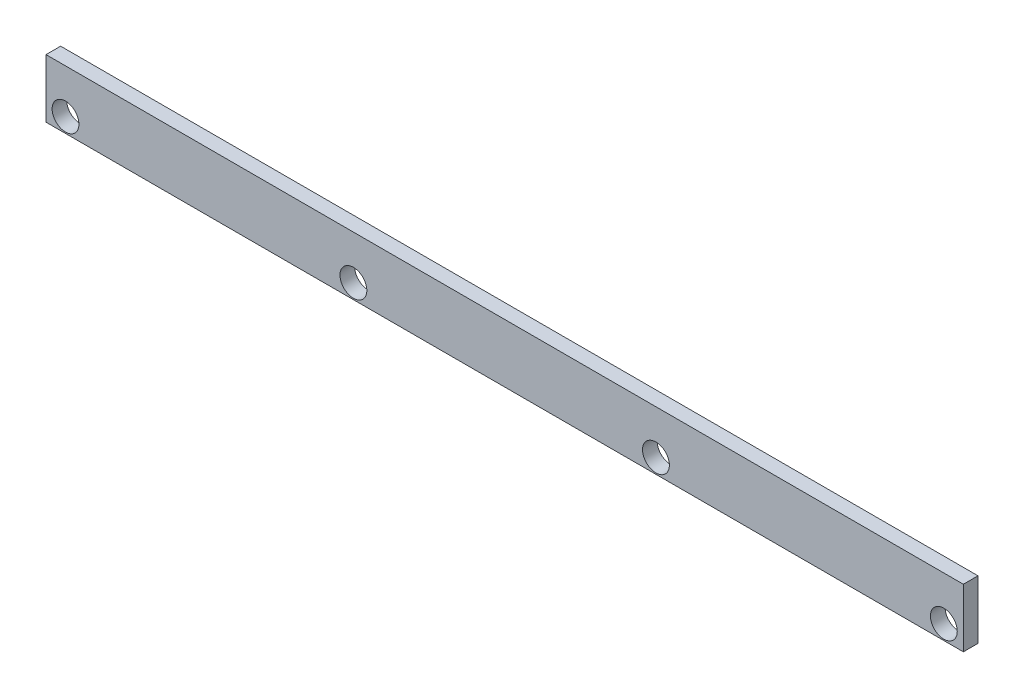
from build123d import *

# Parameters (mm, degrees)
FLOOR_JOINT_HOLES_PROFILE_W = 188
FLOOR_JOINT_HOLES_PROFILE_H = 12
FLOOR_JOINT_HOLES_PROFILE_R = 2.75
FLOOR_JOINT_HOLES_DEPTH     = 3


with BuildPart() as part:
    # Floor joint holes profile → Floor joint holes (new body)
    with BuildSketch(Plane.XY):
        with Locations((0, -6)):
            Rectangle(FLOOR_JOINT_HOLES_PROFILE_W, FLOOR_JOINT_HOLES_PROFILE_H)
        with Locations((-90, -9)):
            Circle(FLOOR_JOINT_HOLES_PROFILE_R, mode=Mode.SUBTRACT)
        with Locations((-31, -9)):
            Circle(FLOOR_JOINT_HOLES_PROFILE_R, mode=Mode.SUBTRACT)
        with Locations((31, -9)):
            Circle(FLOOR_JOINT_HOLES_PROFILE_R, mode=Mode.SUBTRACT)
        with Locations((90, -9)):
            Circle(FLOOR_JOINT_HOLES_PROFILE_R, mode=Mode.SUBTRACT)
    extrude(amount=FLOOR_JOINT_HOLES_DEPTH)


solid = part.part
